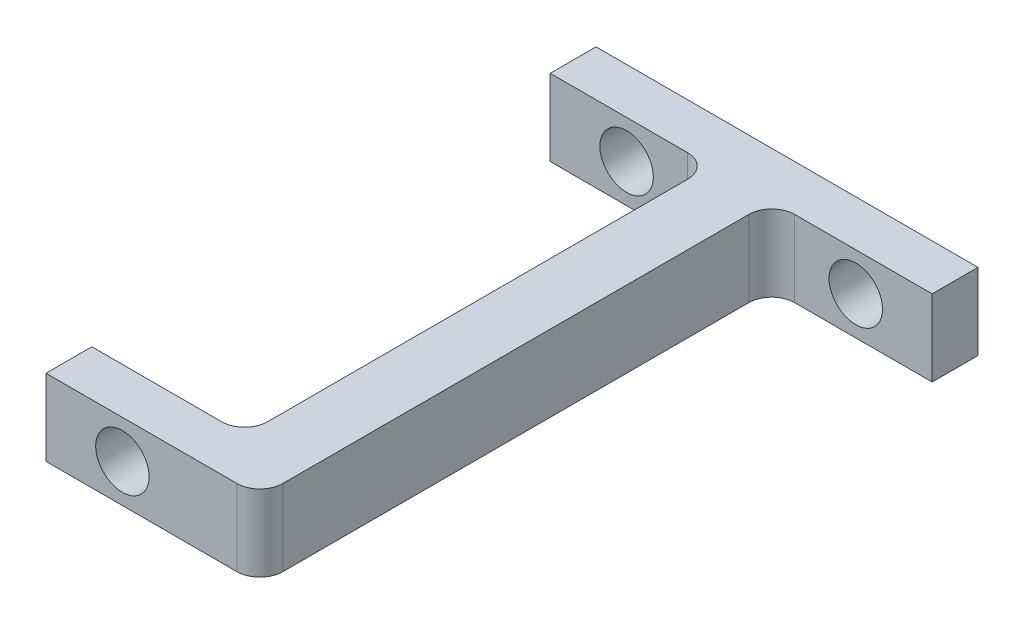
from build123d import *

# Parameters (mm, degrees)
SKETCH1_W           = 25
SKETCH1_H           = 5
SKETCH1_R           = 1.75
BOSS_EXTRUDE1_DEPTH = 3
SKETCH2_W           = 4
SKETCH2_H           = 5
BOSS_EXTRUDE2_DEPTH = 33.5
SKETCH3_W           = 3
SKETCH3_H           = 5
BOSS_EXTRUDE3_DEPTH = 10
SKETCH4_R           = 1.75
CUT_EXTRUDE1_DEPTH  = 10
FILLET1_R           = 1.5


with BuildPart() as part:
    # Sketch1 → Boss-Extrude1 (new body)
    with BuildSketch(Plane.XY):
        Rectangle(SKETCH1_W, SKETCH1_H)
        with Locations((-7.5, 0)):
            Circle(SKETCH1_R, mode=Mode.SUBTRACT)
        with Locations(Location((7.5, 0, 0), (0, 0, 180))):
            Circle(SKETCH1_R, mode=Mode.SUBTRACT)
    extrude(amount=BOSS_EXTRUDE1_DEPTH)

    # Sketch2 → Boss-Extrude2 (add)
    with BuildSketch(Plane.XY.offset(3)):
        Rectangle(SKETCH2_W, SKETCH2_H)
    extrude(amount=BOSS_EXTRUDE2_DEPTH)

    # Sketch3 → Boss-Extrude3 (add)
    with BuildSketch(Plane.ZY.offset(2)):
        with Locations((35, 0)):
            Rectangle(SKETCH3_W, SKETCH3_H)
    extrude(amount=BOSS_EXTRUDE3_DEPTH)

    # Sketch4 → Cut-Extrude1 (cut)
    with BuildSketch(Plane(origin=(0, 0, 33.5), x_dir=(-1, 0, 0), z_dir=(0, 0, -1))):
        with Locations((7, 0)):
            Circle(SKETCH4_R)
    extrude(amount=-CUT_EXTRUDE1_DEPTH, mode=Mode.SUBTRACT)

    # Fillet1
    fillet1_edges = [part.edges().sort_by_distance(p)[0] for p in [
        (-2, 0, 3),
        (2, 0, 3),
        (2, 0, 36.5),
        (-2, 0, 33.5),
    ]]
    fillet(fillet1_edges, radius=FILLET1_R)


solid = part.part
